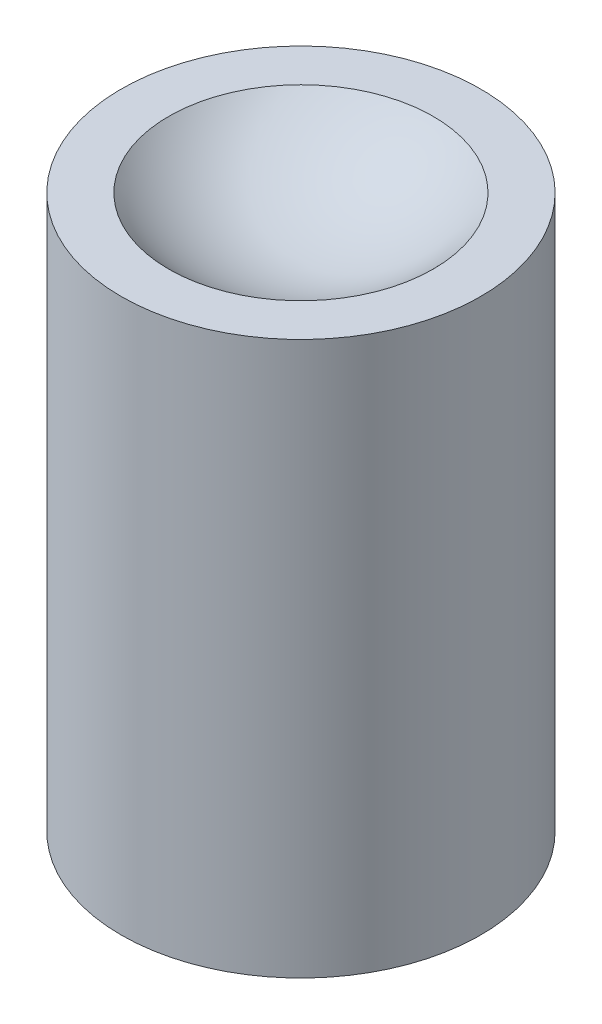
from build123d import *

# Parameters (mm, degrees)
SKETCH1_R           = 6.5
BOSS_EXTRUDE1_DEPTH = 20
SKETCH2_R           = 2
CUT_EXTRUDE1_DEPTH  = 7


with BuildPart() as part:
    # Sketch1 → Boss-Extrude1 (new body)
    with BuildSketch(Plane(origin=(0, 0, 0), x_dir=(1, 0, 0), z_dir=(0, 1, 0))):
        with Locations(Location((0, 0, 0), (0, 0, 270))):
            Circle(SKETCH1_R)
    extrude(amount=BOSS_EXTRUDE1_DEPTH)

    # Sketch2 → Cut-Extrude1 (cut)
    with BuildSketch(Plane.XZ):
        with Locations(Location((0, 0, 0), (0, 0, 270))):
            Circle(SKETCH2_R)
    extrude(amount=-CUT_EXTRUDE1_DEPTH, mode=Mode.SUBTRACT)

    # Sketch3 → Cut-Revolve1 (revolve, cut)
    with BuildSketch(Plane.XY):
        with BuildLine():
            Line((0, 30.9), (0, 17.9))
            ThreePointArc((0, 17.9), (-6.5, 24.4), (0, 30.9))
        make_face()
    revolve(axis=Axis((0, 20, 0), (0, -1, 0)), mode=Mode.SUBTRACT)


solid = part.part
